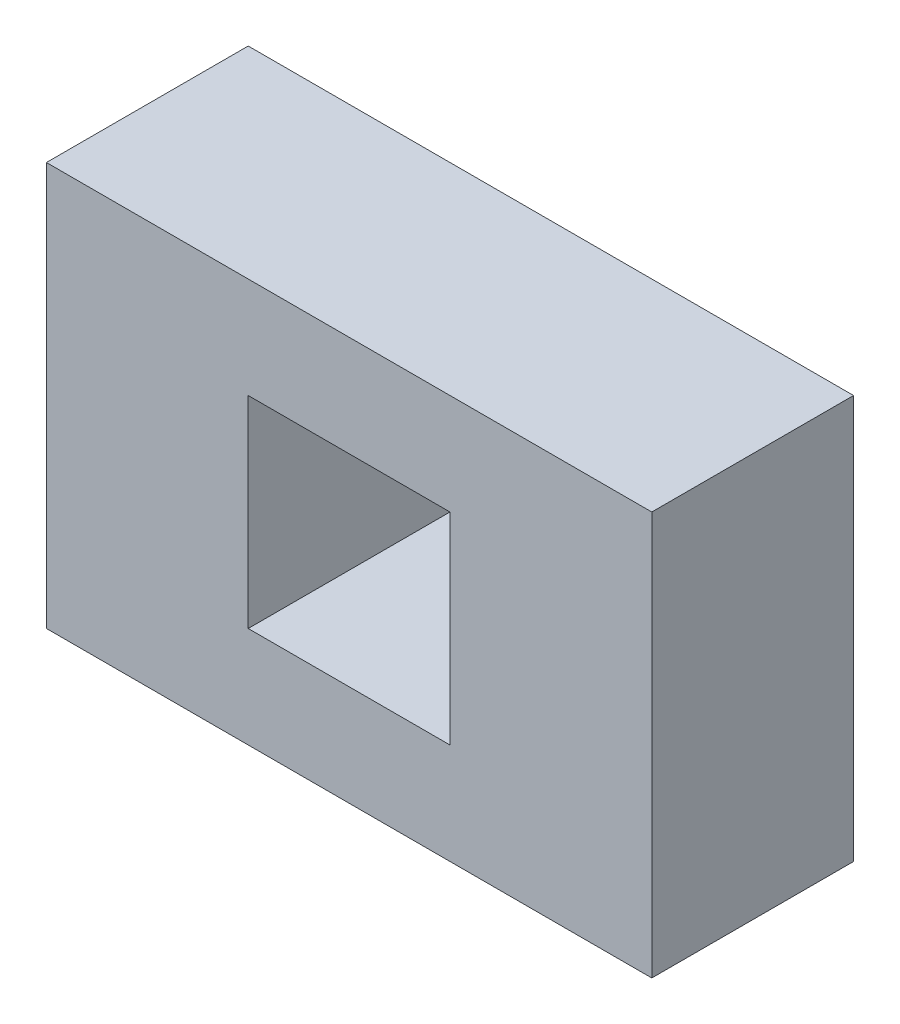
from build123d import *

# Parameters (mm, degrees)
ESQUISSE1_W        = 15
ESQUISSE1_H        = 10
ESQUISSE1_W_2      = 5
ESQUISSE1_H_2      = 5
BOSS_EXTRU_1_DEPTH = 5


with BuildPart() as part:
    # Esquisse1 → Boss.-Extru.1 (new body)
    with BuildSketch(Plane.XY):
        with Locations((7.5, 5)):
            Rectangle(ESQUISSE1_W, ESQUISSE1_H)
        with Locations((7.5, 5)):
            Rectangle(ESQUISSE1_W_2, ESQUISSE1_H_2, mode=Mode.SUBTRACT)
    extrude(amount=BOSS_EXTRU_1_DEPTH)


solid = part.part
